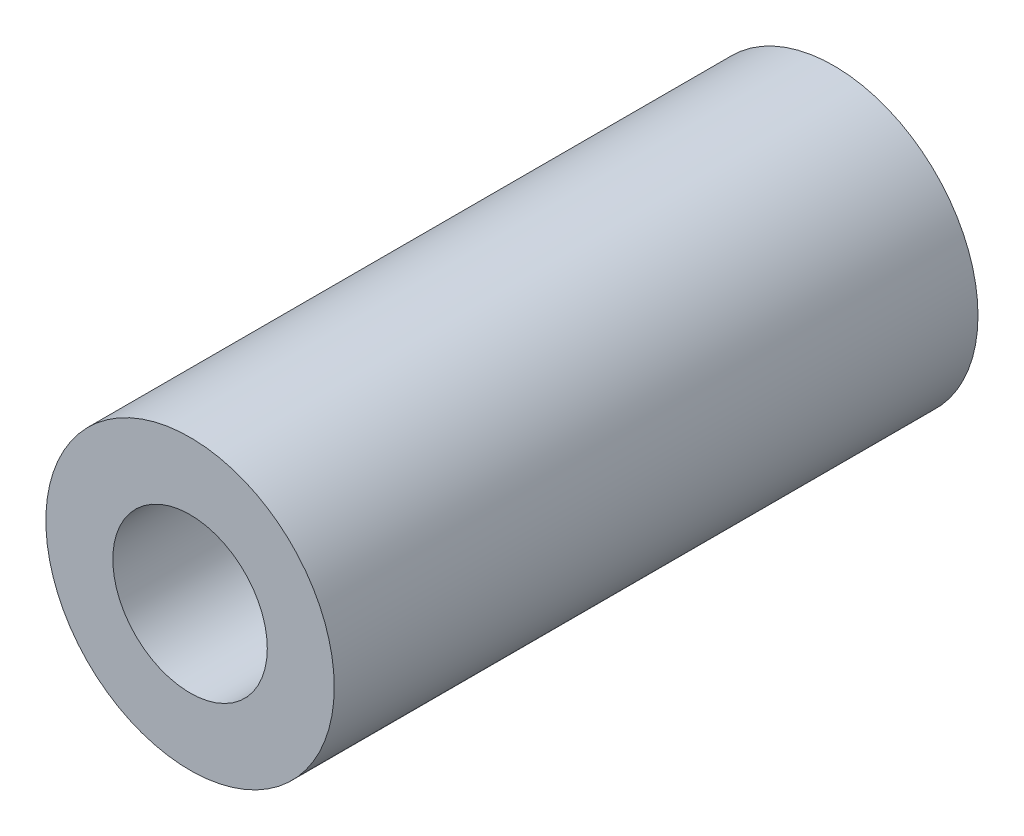
from build123d import *

# Parameters (mm, degrees)
ESQUISSE1_R        = 2.8
ESQUISSE1_R_2      = 1.5
BOSS_EXTRU_1_DEPTH = 12.5


with BuildPart() as part:
    # Esquisse1 → Boss.-Extru.1 (new body)
    with BuildSketch(Plane.XY):
        Circle(ESQUISSE1_R)
        Circle(ESQUISSE1_R_2, mode=Mode.SUBTRACT)
    extrude(amount=BOSS_EXTRU_1_DEPTH)


solid = part.part
